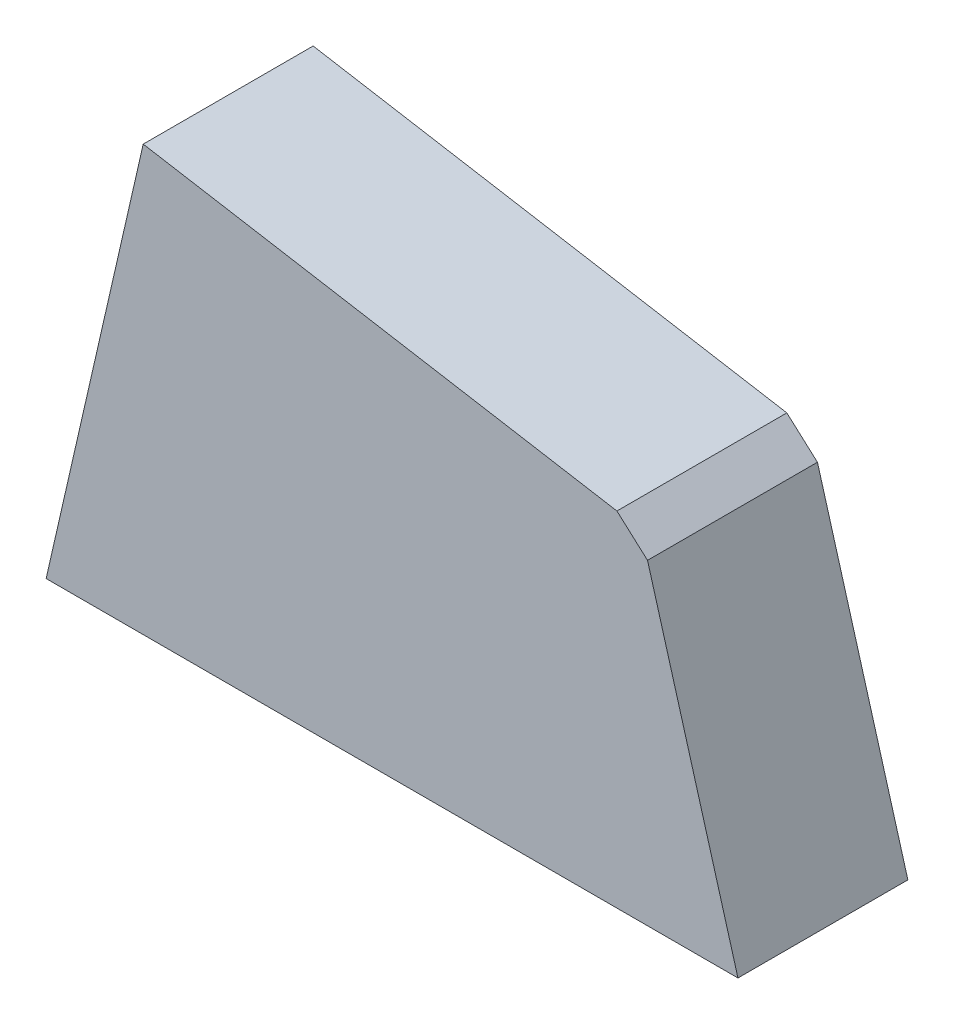
from build123d import *

# Parameters (mm, degrees)
BOSS_EXTRUDE1_DEPTH = 14
CHAMFER1_SIZE       = 2


with BuildPart() as part:
    # Sketch1 → Boss-Extrude1 (new body)
    with BuildSketch(Plane.XY):
        Polygon((4, 3), (61, 3), (53, 31), (12, 38), align=None)
    extrude(amount=BOSS_EXTRUDE1_DEPTH)

    # Chamfer1
    chamfer1_edges = [part.edges().sort_by_distance(p)[0] for p in [
        (53, 31, 7),
    ]]
    chamfer(chamfer1_edges, length=CHAMFER1_SIZE)


solid = part.part
